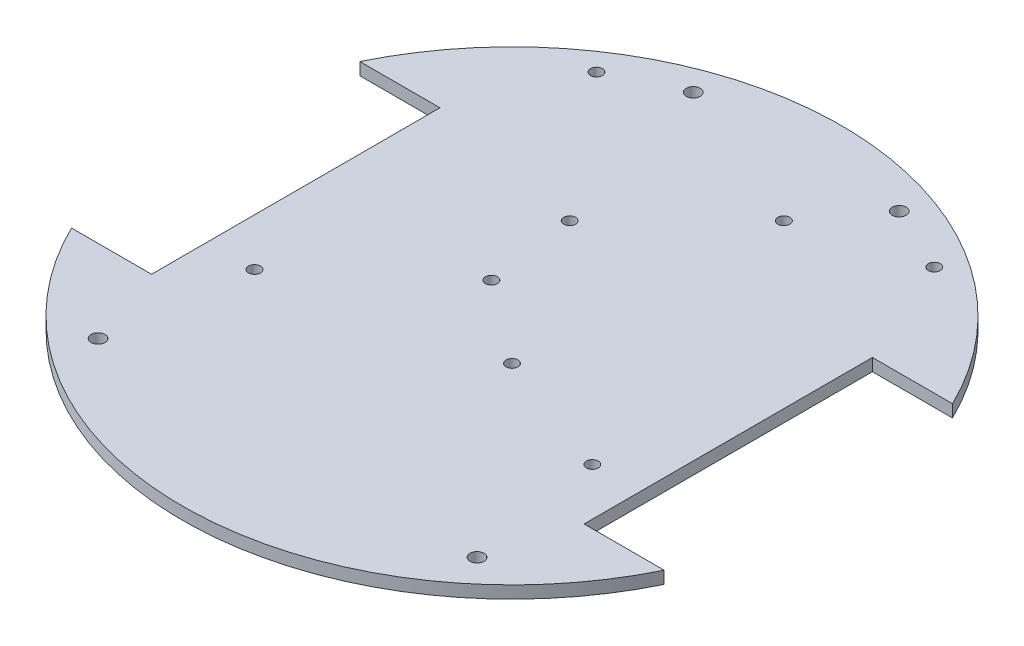
from build123d import *

# Parameters (mm, degrees)
ESQUISSE1_R             = 80
BOSS_EXTRU_1_DEPTH      = 3
ESQUISSE2_W             = 55
ESQUISSE2_H             = 70
ENL_V_MAT_EXTRU_1_DEPTH = 114.176852757
D_GAGEMENT_M2_51_D      = 2.9
D_GAGEMENT_M2_51_DEPTH  = 24
D_GAGEMENT_M2_51_TIP    = 0.871247898
D_GAGEMENT_M2_52_D      = 2.9
D_GAGEMENT_M2_52_DEPTH  = 24
D_GAGEMENT_M2_52_TIP    = 0.871247898
D_GAGEMENT_M31_D        = 3.4
D_GAGEMENT_M31_DEPTH    = 24
D_GAGEMENT_M31_TIP      = 1.021463052


with BuildPart() as part:
    # Esquisse1 → Boss.-Extru.1 (new body)
    with BuildSketch(Plane(origin=(0, 0, 0), x_dir=(1, 0, 0), z_dir=(0, 1, 0))):
        with Locations(Location((0, 0, 0), (0, 0, 270))):
            Circle(ESQUISSE1_R)
    extrude(amount=BOSS_EXTRU_1_DEPTH)

    # Esquisse2 → Enlèv. mat.-Extru.1 (cut, through all)
    with BuildSketch(Plane(origin=(0, 3, 0), x_dir=(1, 0, 0), z_dir=(0, 1, 0))):
        with Locations((-80, 0)):
            Rectangle(ESQUISSE2_W, ESQUISSE2_H)
        with Locations((80, 0)):
            Rectangle(ESQUISSE2_W, ESQUISSE2_H)
    extrude(amount=-ENL_V_MAT_EXTRU_1_DEPTH, mode=Mode.SUBTRACT)

    # Dégagement M2.51
    with Locations(Plane(origin=(0, 3, 0), x_dir=(1, 0, 0), z_dir=(0, 1, 0))):
        with Locations((-41, 61.5), (-41, -21.5), (41, -21.5), (41, 61.5)):
            Hole(D_GAGEMENT_M2_51_D / 2, depth=D_GAGEMENT_M2_51_DEPTH)
            with Locations((0, 0, -(D_GAGEMENT_M2_51_DEPTH + D_GAGEMENT_M2_51_TIP / 2))):  # 118° drill point
                Cone(0, D_GAGEMENT_M2_51_D / 2, D_GAGEMENT_M2_51_TIP, mode=Mode.SUBTRACT)

    # Dégagement M2.52
    with Locations(Plane(origin=(0, 3, 0), x_dir=(1, 0, 0), z_dir=(0, 1, 0))):
        with Locations((-13, 27), (13, 53), (-10, 5), (10, -10)):
            Hole(D_GAGEMENT_M2_52_D / 2, depth=D_GAGEMENT_M2_52_DEPTH)
            with Locations((0, 0, -(D_GAGEMENT_M2_52_DEPTH + D_GAGEMENT_M2_52_TIP / 2))):  # 118° drill point
                Cone(0, D_GAGEMENT_M2_52_D / 2, D_GAGEMENT_M2_52_TIP, mode=Mode.SUBTRACT)

    # Dégagement M31
    with Locations(Plane(origin=(0, 3, 0), x_dir=(1, 0, 0), z_dir=(0, 1, 0))):
        with Locations((-45.483572208, -55), (46.516427792, -55), (-25, 69), (25, 69)):
            Hole(D_GAGEMENT_M31_D / 2, depth=D_GAGEMENT_M31_DEPTH)
            with Locations((0, 0, -(D_GAGEMENT_M31_DEPTH + D_GAGEMENT_M31_TIP / 2))):  # 118° drill point
                Cone(0, D_GAGEMENT_M31_D / 2, D_GAGEMENT_M31_TIP, mode=Mode.SUBTRACT)


solid = part.part
